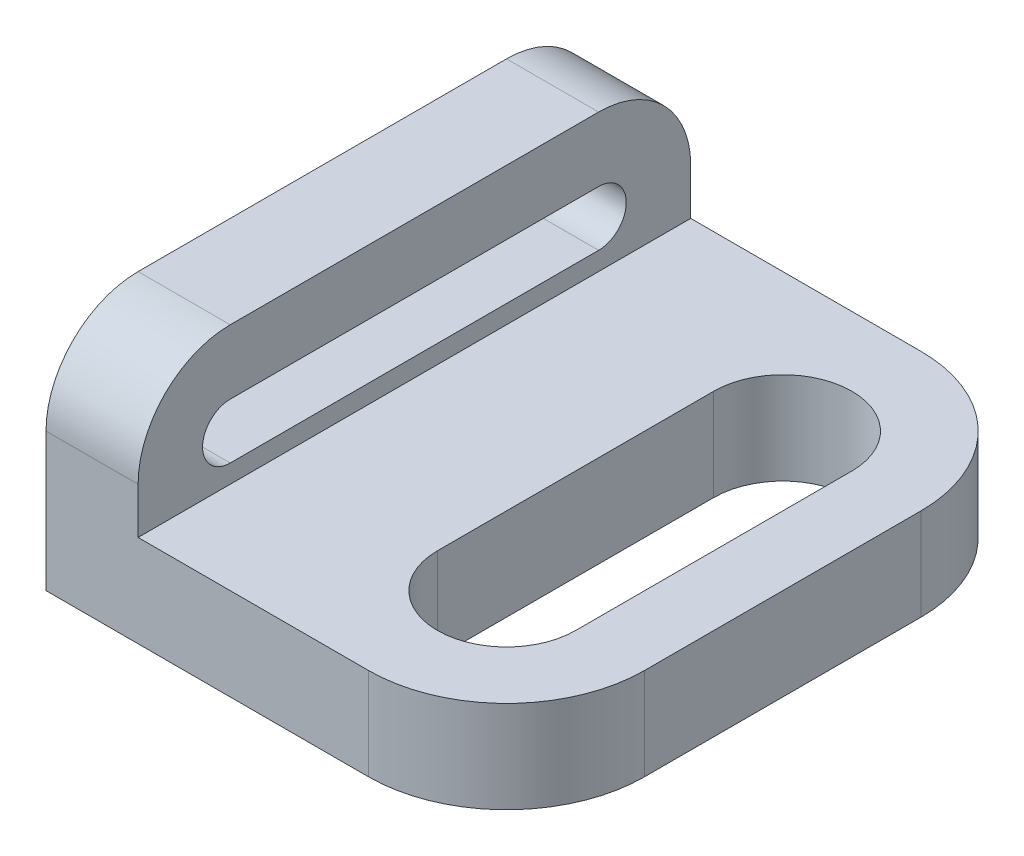
from build123d import *

# Parameters (mm, degrees)
BOSS_EXTRUDE1_DEPTH = 20
SKETCH2_3_W         = 20
SKETCH2_3_H         = 120
BOSS_EXTRUDE2_DEPTH = 50
FILLET1_R           = 20
CUT_EXTRUDE1_DEPTH  = 20


with BuildPart() as part:
    # Sketch2 → Boss-Extrude1 (new body)
    with BuildSketch(Plane(origin=(0, 0, 0), x_dir=(1, 0, 0), z_dir=(0, 1, 0))):
        with BuildLine():
            Line((70, 120), (20, 120))
            Line((20, 120), (20, 0))
            Line((20, 0), (70, 0))
            ThreePointArc((70, 0), (91.213203436, 8.786796564), (100, 30))
            Line((100, 30), (100, 90))
            ThreePointArc((100, 90), (91.213203436, 111.213203436), (70, 120))
        make_face()
        with BuildLine():
            Line((55, 30), (55, 90))
            ThreePointArc((55, 90), (70, 105), (85, 90))
            Line((85, 90), (85, 30))
            ThreePointArc((85, 30), (70, 15), (55, 30))
        make_face(mode=Mode.SUBTRACT)
    extrude(amount=BOSS_EXTRUDE1_DEPTH)

    # Sketch2<3> → Boss-Extrude2 (add)
    with BuildSketch(Plane(origin=(0, 0, 0), x_dir=(1, 0, 0), z_dir=(0, 1, 0))):
        with Locations((10, 60)):
            Rectangle(SKETCH2_3_W, SKETCH2_3_H)
    extrude(amount=BOSS_EXTRUDE2_DEPTH)

    # Fillet1
    fillet1_edges = [part.edges().sort_by_distance(p)[0] for p in [
        (10, 50, -120),
        (10, 50, 0),
    ]]
    fillet(fillet1_edges, radius=FILLET1_R)

    # Sketch3 → Cut-Extrude1 (cut)
    with BuildSketch(Plane(origin=(20, 0, 0), x_dir=(0, 0, -1), z_dir=(1, 0, 0))):
        with BuildLine():
            Line((20, 24), (100, 24))
            ThreePointArc((100, 24), (106, 30), (100, 36))
            Line((100, 36), (20, 36))
            ThreePointArc((20, 36), (14, 30), (20, 24))
        make_face()
    extrude(amount=-CUT_EXTRUDE1_DEPTH, mode=Mode.SUBTRACT)


solid = part.part
